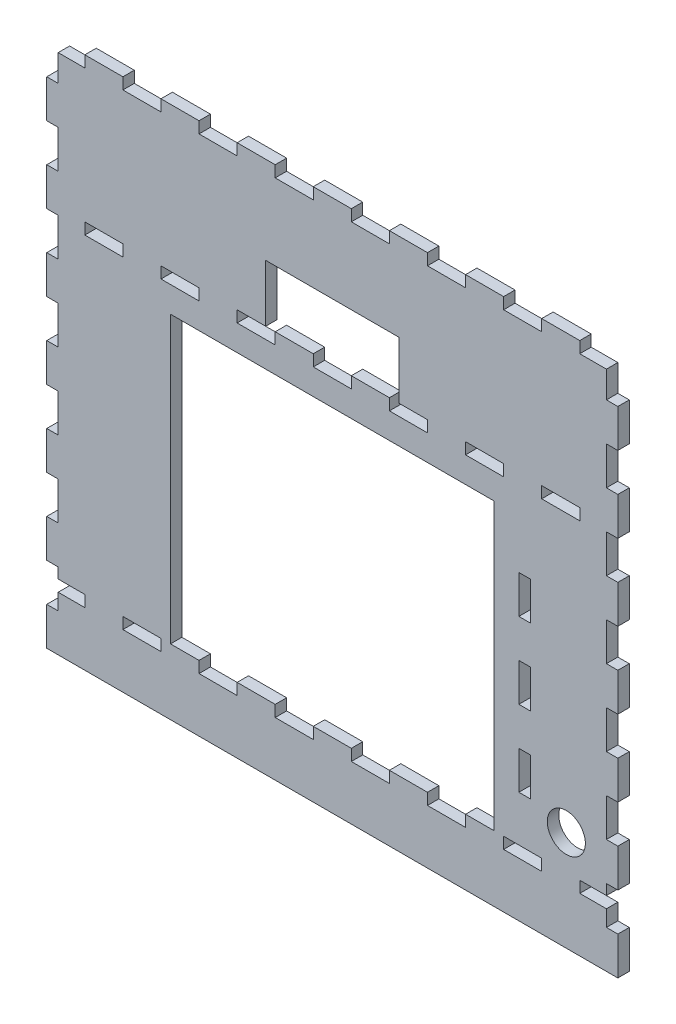
from build123d import *

# Parameters (mm, degrees)
CROQUIS1_W              = 10
CROQUIS1_H              = 3
CROQUIS1_W_2            = 3
CROQUIS1_H_2            = 10
CROQUIS1_R              = 5
SALIENTE_EXTRUIR1_DEPTH = 3


with BuildPart() as part:
    # Croquis1 → Saliente-Extruir1 (new body)
    with BuildSketch(Plane.XY):
        Polygon((-35, 71.5), (-45, 71.5), (-45, 68.5), (-55, 68.5), (-55, 71.5), (-65, 71.5), (-65, 68.5), (-72, 68.5), (-72, 61.5), (-75, 61.5), (-75, 51.5), (-72, 51.5), (-72, 41.5), (-75, 41.5), (-75, 31.5), (-72, 31.5), (-72, 21.5), (-75, 21.5), (-75, 11.5), (-72, 11.5), (-72, 1.5), (-75, 1.5), (-75, -8.5), (-72, -8.5), (-72, -18.5), (-75, -18.5), (-75, -28.5), (-72, -28.5), (-72, -38.5), (-75, -38.5), (-75, -48.5), (-72, -48.5), (-72, -51.25), (-65, -51.25), (-65, -54.25), (-72, -54.25), (-72, -58.5), (-75, -58.5), (-75, -68.5), (-72, -68.5), (72, -68.5), (75, -68.5), (75, -58.5), (72, -58.5), (72, -54.25), (65, -54.25), (65, -51.25), (72, -51.25), (72, -48.5), (75, -48.5), (75, -38.5), (72, -38.5), (72, -28.5), (75, -28.5), (75, -18.5), (72, -18.5), (72, -8.5), (75, -8.5), (75, 1.5), (72, 1.5), (72, 11.5), (75, 11.5), (75, 21.5), (72, 21.5), (72, 31.5), (75, 31.5), (75, 41.5), (72, 41.5), (72, 51.5), (75, 51.5), (75, 61.5), (72, 61.5), (72, 68.5), (65, 68.5), (65, 71.5), (55, 71.5), (55, 68.5), (45, 68.5), (45, 71.5), (35, 71.5), (35, 68.5), (25, 68.5), (25, 71.5), (15, 71.5), (15, 68.5), (5, 68.5), (5, 71.5), (-5, 71.5), (-5, 68.5), (-15, 68.5), (-15, 71.5), (-25, 71.5), (-25, 68.5), (-35, 68.5), align=None)
        with Locations((-50, -52.75)):
            Rectangle(CROQUIS1_W, CROQUIS1_H, mode=Mode.SUBTRACT)
        Polygon((-35, -54.25), (-35, -51.25), (-42.5, -51.25), (-42.5, 23.75), (42.5, 23.75), (42.5, -51.25), (35, -51.25), (35, -54.25), (25, -54.25), (25, -51.25), (15, -51.25), (15, -54.25), (5, -54.25), (5, -51.25), (-5, -51.25), (-5, -54.25), (-15, -54.25), (-15, -51.25), (-25, -51.25), (-25, -54.25), align=None, mode=Mode.SUBTRACT)
        with Locations((50, -52.75)):
            Rectangle(CROQUIS1_W, CROQUIS1_H, mode=Mode.SUBTRACT)
        with Locations((50.5, -34.25)):
            Rectangle(CROQUIS1_W_2, CROQUIS1_H_2, mode=Mode.SUBTRACT)
        with Locations((61.473213392, -42.174074015)):
            Circle(CROQUIS1_R, mode=Mode.SUBTRACT)
        with Locations((50.5, -14.25)):
            Rectangle(CROQUIS1_W_2, CROQUIS1_H_2, mode=Mode.SUBTRACT)
        with Locations((-60, 32)):
            Rectangle(CROQUIS1_W, CROQUIS1_H, mode=Mode.SUBTRACT)
        with Locations((-40, 32)):
            Rectangle(CROQUIS1_W, CROQUIS1_H, mode=Mode.SUBTRACT)
        Polygon((-25, 30.5), (-25, 33.5), (-17.5, 33.5), (-17.5, 48.5), (17.5, 48.5), (17.5, 33.5), (25, 33.5), (25, 30.5), (15, 30.5), (15, 33.5), (5, 33.5), (5, 30.5), (-5, 30.5), (-5, 33.5), (-15, 33.5), (-15, 30.5), align=None, mode=Mode.SUBTRACT)
        with Locations((50.5, 5.75)):
            Rectangle(CROQUIS1_W_2, CROQUIS1_H_2, mode=Mode.SUBTRACT)
        with Locations((40, 32)):
            Rectangle(CROQUIS1_W, CROQUIS1_H, mode=Mode.SUBTRACT)
        with Locations((60, 32)):
            Rectangle(CROQUIS1_W, CROQUIS1_H, mode=Mode.SUBTRACT)
    extrude(amount=SALIENTE_EXTRUIR1_DEPTH)


solid = part.part
